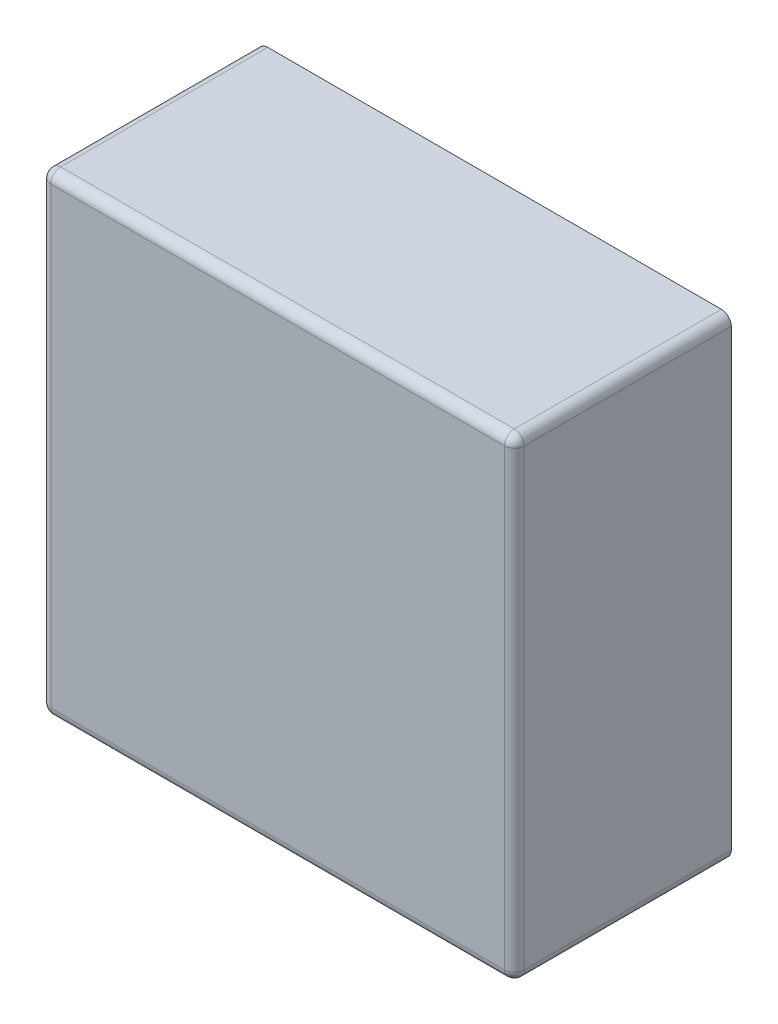
from build123d import *

# Parameters (mm, degrees)
BOSS_EXTRU_1_DEPTH      = 4.3
ESQUISSE2_W             = 5.6
ESQUISSE2_H             = 2.4
BOSS_EXTRU_2_DEPTH      = 0.65
ESQUISSE3_W             = 2.4
ESQUISSE3_H             = 4.95
BOSS_EXTRU_3_DEPTH      = 2.4
ESQUISSE4_W             = 8
ESQUISSE4_H             = 2.4
BOSS_EXTRU_4_DEPTH      = 3.85
ESQUISSE5_W             = 2.4
ESQUISSE5_H             = 8.8
BOSS_EXTRU_5_DEPTH      = 3.2
ESQUISSE6_W             = 2.35
ESQUISSE6_H             = 0.9
BOSS_EXTRU_6_DEPTH      = 3.1
ESQUISSE7_W             = 0.9
ESQUISSE7_H             = 4.3
BOSS_EXTRU_7_DEPTH      = 0.4
ESQUISSE8_W             = 0.9
ESQUISSE8_H             = 4.3
BOSS_EXTRU_8_DEPTH      = 0.4
ESQUISSE9_W             = 5.5
ESQUISSE9_H             = 8.8
BOSS_EXTRU_9_DEPTH      = 0.8
BOSS_EXTRU_10_DEPTH     = 2.4
ESQUISSE11_W            = 12
ESQUISSE11_H            = 5.5
BOSS_EXTRU_11_DEPTH     = 0.8
ENL_V_MAT_EXTRU_1_DEPTH = 1.6
ENL_V_MAT_EXTRU_2_REACH = 12.401
ESQUISSE13_W            = 1.425
ESQUISSE13_H            = 1.6
ENL_V_MAT_EXTRU_3_REACH = 12.401
ESQUISSE14_W            = 1.425
ESQUISSE14_H            = 1.6
ENL_V_MAT_EXTRU_4_DEPTH = 1.6
CONG_1_R                = 0.25


with BuildPart() as part:
    # Esquisse1 → Boss.-Extru.1 (new body)
    with BuildSketch(Plane.XZ.offset(2.15)):
        with BuildLine():
            Line((1.9, 0.4), (2.8, 0.4))
            Line((2.8, 0.4), (2.8, 5.5))
            Line((2.8, 5.5), (-2.8, 5.5))
            Line((-2.8, 5.5), (-2.8, 0.4))
            Line((-2.8, 0.4), (-1.9, 0.4))
            ThreePointArc((-1.9, 0.4), (-1.72, 0.7), (-1.9, 1))
            Line((-1.9, 1), (-1.9, 3.1))
            Line((-1.9, 3.1), (1.9, 3.1))
            Line((1.9, 3.1), (1.9, 1))
            ThreePointArc((1.9, 1), (1.72, 0.7), (1.9, 0.4))
        make_face()
    extrude(amount=-BOSS_EXTRU_1_DEPTH)

    # Esquisse2 → Boss.-Extru.2 (add)
    with BuildSketch(Plane.XZ.offset(2.15)):
        with Locations((0, 4.3)):
            Rectangle(ESQUISSE2_W, ESQUISSE2_H)
    extrude(amount=BOSS_EXTRU_2_DEPTH)

    # Esquisse3 → Boss.-Extru.3 (add)
    with BuildSketch(Plane.ZY.offset(2.8)):
        with Locations((4.3, -0.325)):
            Rectangle(ESQUISSE3_W, ESQUISSE3_H)
    extrude(amount=BOSS_EXTRU_3_DEPTH)

    # Esquisse4 → Boss.-Extru.4 (add)
    with BuildSketch(Plane(origin=(0, 2.15, 0), x_dir=(-1, 0, 0), z_dir=(0, 1, 0))):
        with Locations((1.2, 4.3)):
            Rectangle(ESQUISSE4_W, ESQUISSE4_H)
    extrude(amount=BOSS_EXTRU_4_DEPTH)

    # Esquisse5 → Boss.-Extru.5 (add)
    with BuildSketch(Plane(origin=(2.8, 0, 0), x_dir=(0, 0, -1), z_dir=(1, 0, 0))):
        with Locations((-4.3, 1.6)):
            Rectangle(ESQUISSE5_W, ESQUISSE5_H)
    extrude(amount=BOSS_EXTRU_5_DEPTH)

    # Esquisse6 → Boss.-Extru.6 (add)
    with BuildSketch(Plane(origin=(0, 0, 3.1), x_dir=(-1, 0, 0), z_dir=(0, 0, -1))):
        Polygon((5.2, 5.2), (0.475, 5.2), (0.475, 2.8), (1.175, 2.8), (1.175, 1.9), (-1.175, 1.9), (-1.175, 2.8), (-0.475, 2.8), (-0.475, 5.2), (-5.2, 5.2), (-5.2, -2.8), (-6, -2.8), (-6, 6), (5.2, 6), align=None)
        with Locations((0, -2.35)):
            Rectangle(ESQUISSE6_W, ESQUISSE6_H)
    extrude(amount=BOSS_EXTRU_6_DEPTH)

    # Esquisse7 → Boss.-Extru.7 (add)
    with BuildSketch(Plane(origin=(0, 0, 0.4), x_dir=(-1, 0, 0), z_dir=(0, 0, -1))):
        with Locations((2.35, 0)):
            Rectangle(ESQUISSE7_W, ESQUISSE7_H)
    extrude(amount=BOSS_EXTRU_7_DEPTH)

    # Esquisse8 → Boss.-Extru.8 (add)
    with BuildSketch(Plane(origin=(0, 0, 0.4), x_dir=(-1, 0, 0), z_dir=(0, 0, -1))):
        with Locations((-2.35, 0)):
            Rectangle(ESQUISSE8_W, ESQUISSE8_H)
    extrude(amount=BOSS_EXTRU_8_DEPTH)

    # Esquisse9 → Boss.-Extru.9 (add)
    with BuildSketch(Plane.ZY.offset(5.2)):
        with Locations((2.75, 1.6)):
            Rectangle(ESQUISSE9_W, ESQUISSE9_H)
    extrude(amount=BOSS_EXTRU_9_DEPTH)

    # Esquisse10 → Boss.-Extru.10 (add)
    with BuildSketch(Plane.XZ.offset(2.8)):
        Polygon((-0.475, 3.1), (-5.2, 3.1), (-5.2, 0), (-6, 0), (-6, 5.5), (6, 5.5), (6, 0), (5.2, 0), (5.2, 3.1), (0.475, 3.1), (0.475, 0), (-0.475, 0), align=None)
    extrude(amount=BOSS_EXTRU_10_DEPTH)

    # Esquisse11 → Boss.-Extru.11 (add)
    with BuildSketch(Plane.XZ.offset(5.2)):
        with Locations((0, 2.75)):
            Rectangle(ESQUISSE11_W, ESQUISSE11_H)
    extrude(amount=BOSS_EXTRU_11_DEPTH)

    # Esquisse12 → Enlèv. mat.-Extru.1 (cut)
    with BuildSketch(Plane(origin=(0, 0, 3.1), x_dir=(-1, 0, 0), z_dir=(0, 0, -1))):
        Polygon((-1.9, 0.475), (-1.175, 0.475), (-1.175, 2.8), (-0.475, 2.8), (-0.475, 5.2), (-5.2, 5.2), (-5.2, -5.2), (-0.475, -5.2), (-0.475, -2.8), (-1.175, -2.8), (-1.175, -0.475), (-1.9, -0.475), (-1.9, -2.15), (-2.8, -2.15), (-2.8, 2.15), (-1.9, 2.15), align=None)
    extrude(amount=-ENL_V_MAT_EXTRU_1_DEPTH, mode=Mode.SUBTRACT)

    # Esquisse13 → Enlèv. mat.-Extru.2 (cut, up to next)
    with BuildSketch(Plane(origin=(0.475, 0, 0), x_dir=(0, -1, 0), z_dir=(-1, 0, 0)), mode=Mode.PRIVATE) as enl_v_mat_extru_2_sk1:
        with Locations((-1.1875, 3.9)):
            Rectangle(ESQUISSE13_W, ESQUISSE13_H)
    enl_v_mat_extru_2_tool1 = extrude(enl_v_mat_extru_2_sk1.sketch, amount=-ENL_V_MAT_EXTRU_2_REACH, mode=Mode.PRIVATE) & part.part
    add(enl_v_mat_extru_2_tool1.solids().sort_by_distance((0.475, 1.1875, 3.9))[0], mode=Mode.SUBTRACT)

    # Esquisse14 → Enlèv. mat.-Extru.3 (cut, up to next)
    with BuildSketch(Plane(origin=(0.475, 0, 0), x_dir=(0, -1, 0), z_dir=(-1, 0, 0)), mode=Mode.PRIVATE) as enl_v_mat_extru_3_sk1:
        with Locations((1.1875, 3.9)):
            Rectangle(ESQUISSE14_W, ESQUISSE14_H)
    enl_v_mat_extru_3_tool1 = extrude(enl_v_mat_extru_3_sk1.sketch, amount=-ENL_V_MAT_EXTRU_3_REACH, mode=Mode.PRIVATE) & part.part
    add(enl_v_mat_extru_3_tool1.solids().sort_by_distance((0.475, -1.1875, 3.9))[0], mode=Mode.SUBTRACT)

    # Esquisse15 → Enlèv. mat.-Extru.4 (cut)
    with BuildSketch(Plane(origin=(0, 0, 3.1), x_dir=(-1, 0, 0), z_dir=(0, 0, -1))):
        Polygon((0.475, 0.475), (1.9, 0.475), (1.9, 2.15), (2.8, 2.15), (2.8, -2.15), (1.9, -2.15), (1.9, -0.475), (0.475, -0.475), (0.475, -1.9), (1.175, -1.9), (1.175, -2.8), (0.475, -2.8), (0.475, -5.2), (5.2, -5.2), (5.2, 5.2), (0.475, 5.2), (0.475, 2.8), (1.175, 2.8), (1.175, 1.9), (0.475, 1.9), align=None)
    extrude(amount=-ENL_V_MAT_EXTRU_4_DEPTH, mode=Mode.SUBTRACT)

    # Congé1
    cong_1_edges = [part.edges().sort_by_distance(p)[0] for p in [
        (-6, 0, 5.5),
        (-6, 6, 2.75),
        (6, -6, 2.75),
        (0, -6, 5.5),
        (-6, -6, 2.75),
        (0, 6, 5.5),
        (6, 6, 2.75),
        (6, 0, 5.5),
    ]]
    fillet(cong_1_edges, radius=CONG_1_R)


solid = part.part
